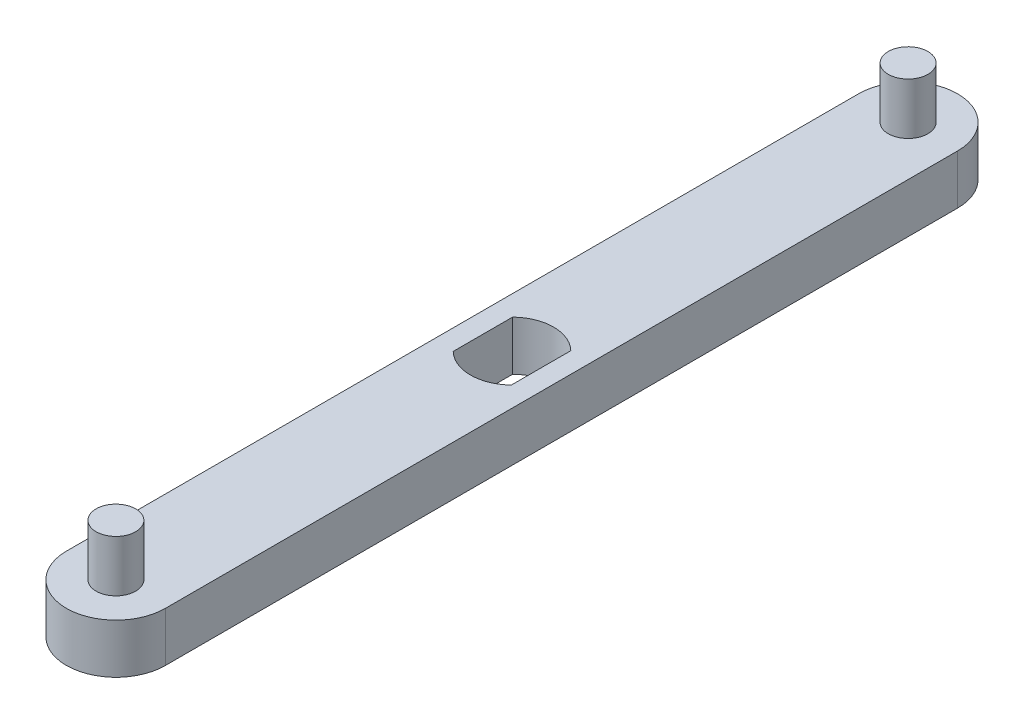
from build123d import *

# Parameters (mm, degrees)
BOSS_EXTRUDE5_DEPTH = 3.175
SKETCH8_R           = 1.27
BOSS_EXTRUDE6_DEPTH = 3.302
CUT_EXTRUDE3_DEPTH  = 30.47138916


with BuildPart() as part:
    # Sketch7 → Boss-Extrude5 (new body)
    with BuildSketch(Plane(origin=(0, 0, 0), x_dir=(1, 0, 0), z_dir=(0, 1, 0))):
        with BuildLine():
            Line((-3.175, 25.4), (-3.175, -25.4))
            ThreePointArc((-3.175, -25.4), (0, -28.575), (3.175, -25.4))
            Line((3.175, -25.4), (3.175, 25.4))
            ThreePointArc((3.175, 25.4), (0, 28.575), (-3.175, 25.4))
        make_face()
    extrude(amount=BOSS_EXTRUDE5_DEPTH)

    # Sketch8 → Boss-Extrude6 (add)
    with BuildSketch(Plane(origin=(0, 3.175, 0), x_dir=(1, 0, 0), z_dir=(0, 1, 0))):
        with Locations(Location((0, 25.4, 0), (0, 0, 90))):
            Circle(SKETCH8_R)
        with Locations(Location((0, -25.4, 0), (0, 0, 90))):
            Circle(SKETCH8_R)
    extrude(amount=BOSS_EXTRUDE6_DEPTH)

    # Sketch9 → Cut-Extrude3 (cut, through all)
    with BuildSketch(Plane.XZ):
        with BuildLine():
            Line((-1.866511184, 1.905), (-1.866511184, -1.905))
            ThreePointArc((-1.866511184, -1.905), (0, -2.667), (1.866511184, -1.905))
            Line((1.866511184, -1.905), (1.866511184, 1.905))
            ThreePointArc((1.866511184, 1.905), (0, 2.667), (-1.866511184, 1.905))
        make_face()
    extrude(amount=-CUT_EXTRUDE3_DEPTH, mode=Mode.SUBTRACT)


solid = part.part
